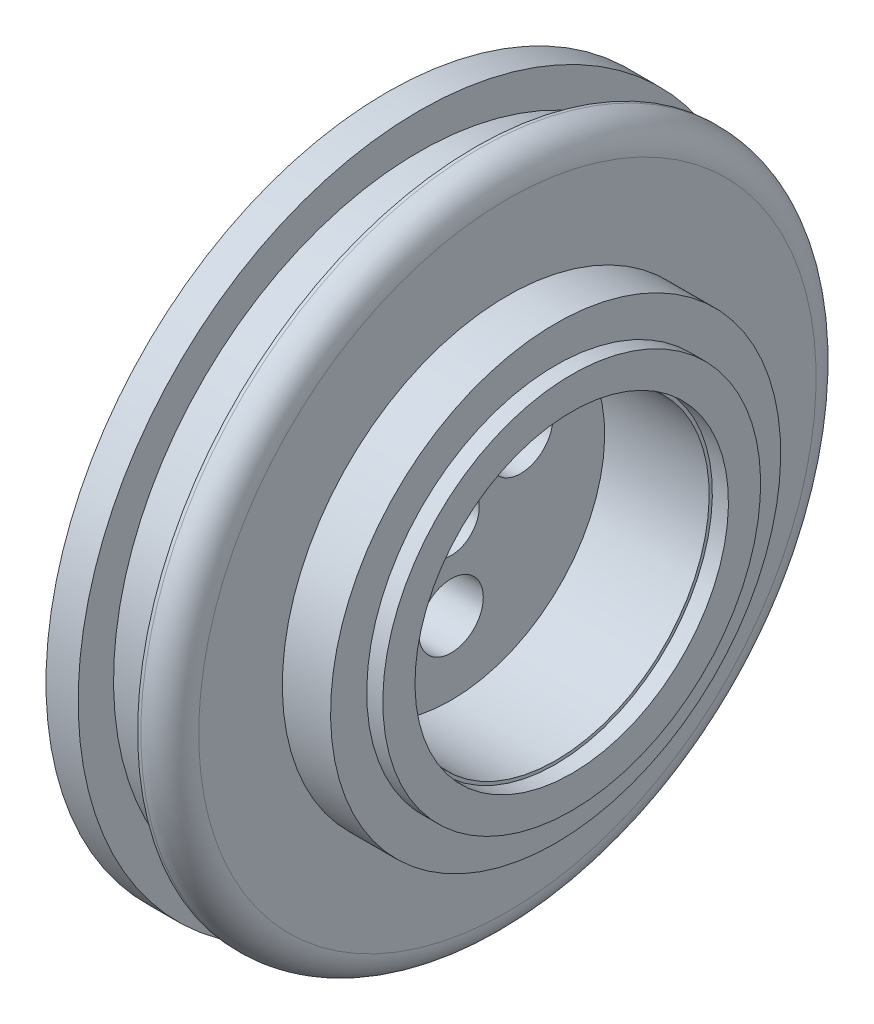
from build123d import *

# Parameters (mm, degrees)
CUT_EXTRUDE2_DEPTH      = 33.111212995
CUT_EXTRUDE2_DEPTH_BACK = 33.111212995
SKETCH2_R               = 1.75
SKETCH2_R_2             = 2


with BuildPart() as part:
    # Sketch1 → Revolve1 (revolve)
    with BuildSketch(Plane.XY, mode=Mode.PRIVATE) as revolve1_sk:
        with BuildLine():
            Line((10.5, 14), (7.5, 14))
            Line((7.5, 14), (7.5, 19.2))
            ThreePointArc((7.5, 19.2), (6.972792206, 20.472792206), (5.7, 21))
            Line((5.7, 21), (5.5, 21))
            Line((5.5, 21), (5.5, 19))
            Line((5.5, 19), (2, 19))
            Line((2, 19), (2, 21.2))
            Line((2, 21.2), (0, 21.2))
            Line((0, 21.2), (0, 0))
            Line((0, 0), (4, 0))
            Line((4, 0), (4, 9.55))
            Line((4, 9.55), (10.5, 9.55))
            Line((10.5, 9.55), (10.5, 9.75))
            Line((10.5, 9.75), (11.5, 9.75))
            Line((11.5, 9.75), (11.5, 11.75))
            Line((11.5, 11.75), (10.5, 11.75))
            Line((10.5, 11.75), (10.5, 14))
        make_face()
    revolve(revolve1_sk.sketch.rotate(Axis((0, 0, 0), (1, 0, 0)), 180), axis=Axis((0, 0, 0), (1, 0, 0)))

    # Sketch2 → Cut-Extrude2 (cut, two sides: drawn at the far end of the back side and taken through both)
    with BuildSketch(Plane(origin=(0, 0, 0), x_dir=(0, 0, -1), z_dir=(1, 0, 0)).offset(-CUT_EXTRUDE2_DEPTH_BACK)):
        Circle(SKETCH2_R)
        with Locations((0, -5)):
            Circle(SKETCH2_R_2)
        with Locations((-4.330127019, 2.5)):
            Circle(SKETCH2_R_2)
        with Locations((4.330127019, 2.5)):
            Circle(SKETCH2_R_2)
    extrude(amount=CUT_EXTRUDE2_DEPTH + CUT_EXTRUDE2_DEPTH_BACK, mode=Mode.SUBTRACT)


solid = part.part
